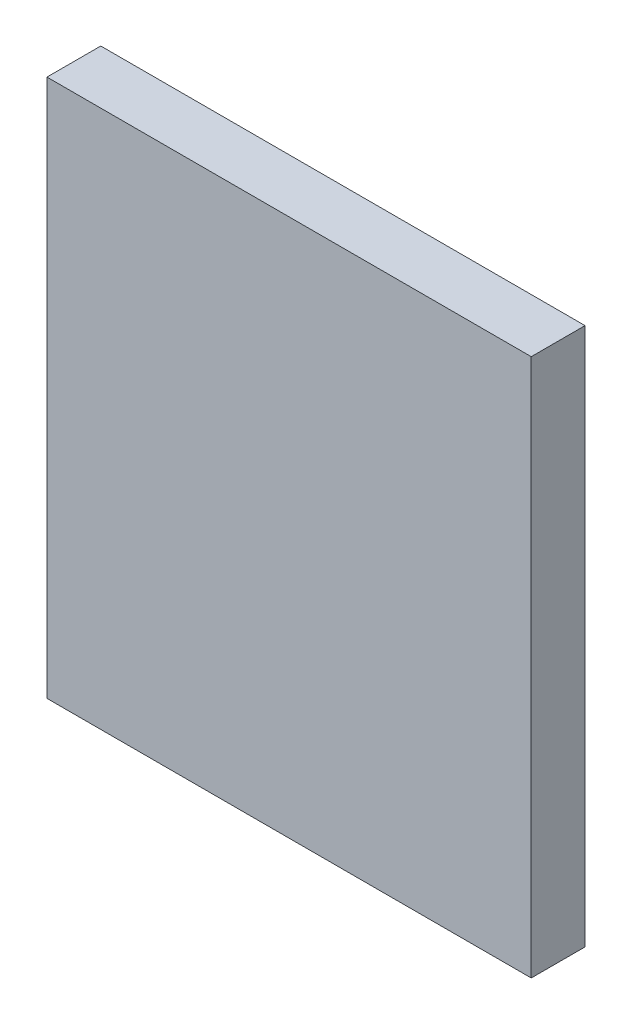
from build123d import *

# Parameters (mm, degrees)
SKETCH1_W           = 90
SKETCH1_H           = 100
BOSS_EXTRUDE1_DEPTH = 2
BOSS_EXTRUDE2_DEPTH = 8
SKETCH3_W           = 4
SKETCH3_H           = 4
CUT_EXTRUDE2_DEPTH  = 3


with BuildPart() as part:
    # Sketch1 → Boss-Extrude1 (new body)
    with BuildSketch(Plane.XY):
        Rectangle(SKETCH1_W, SKETCH1_H)
    extrude(amount=-BOSS_EXTRUDE1_DEPTH)

    # Sketch2 → Boss-Extrude2 (add)
    with BuildSketch(Plane(origin=(0, 0, -2), x_dir=(-1, 0, 0), z_dir=(0, 0, -1))):
        Polygon((-45, 50), (-45, -50), (-40, -50), (-40, -47.5), (-40, 45), (40, 45), (40, -47.5), (40, -50), (45, -50), (45, 50), align=None)
    extrude(amount=BOSS_EXTRUDE2_DEPTH)

    # Sketch3 → Cut-Extrude2 (cut)
    with BuildSketch(Plane(origin=(0, 0, -10), x_dir=(-1, 0, 0), z_dir=(0, 0, -1))):
        with Locations((-42.5, 47.5)):
            Rectangle(SKETCH3_W, SKETCH3_H)
        with Locations((42.5, 47.5)):
            Rectangle(SKETCH3_W, SKETCH3_H)
        with Locations((42.5, -47.5)):
            Rectangle(SKETCH3_W, SKETCH3_H)
        with Locations((-42.5, -47.5)):
            Rectangle(SKETCH3_W, SKETCH3_H)
    extrude(amount=-CUT_EXTRUDE2_DEPTH, mode=Mode.SUBTRACT)


solid = part.part
